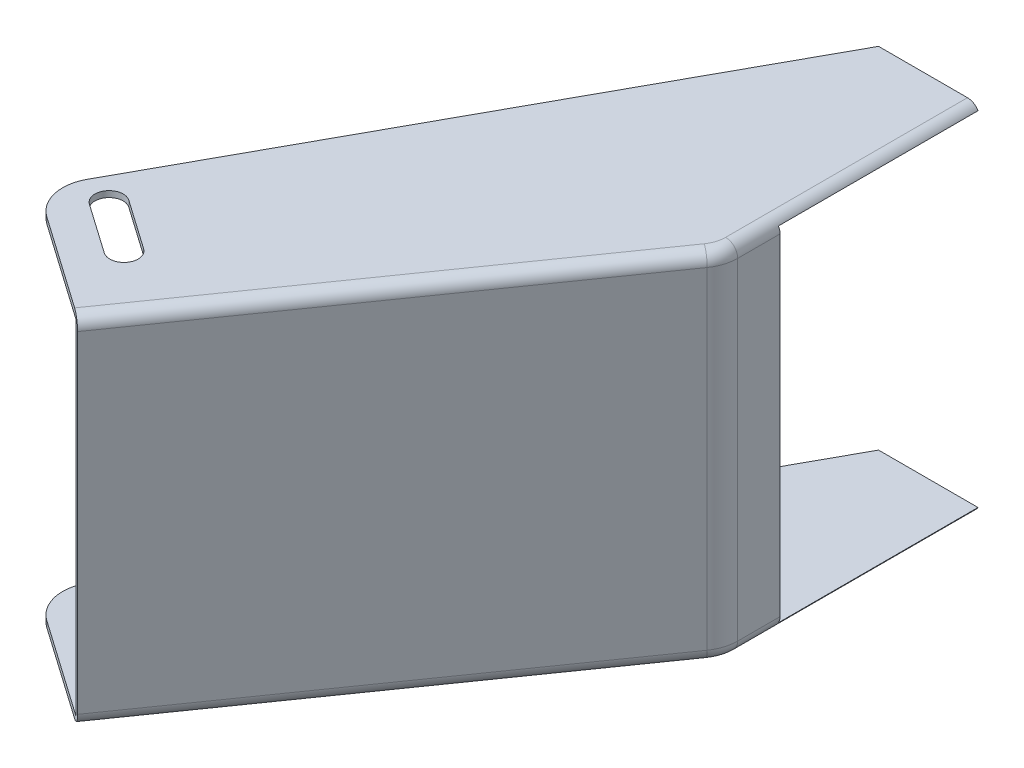
from build123d import *

# Parameters (mm, degrees)
BOSS_EXTRUDE1_DEPTH = 87.5
BOSS_EXTRUDE2_DEPTH = 1.5
FILLET1_R           = 10
FILLET2_R           = 3
CUT_EXTRUDE1_REACH  = 205.273
SKETCH3_W           = 49.374063928
SKETCH3_H           = 85


with BuildPart() as part:
    # Sketch1 → Boss-Extrude1 (new body)
    with BuildSketch(Plane(origin=(0, 0, 0), x_dir=(1, 0, 0), z_dir=(0, 1, 0))):
        Polygon((0, 0), (0, -63), (-65.96129018, -157.202485093), (-67.190018247, -156.342120439), (-1.5, -62.527051817), (-1.5, 0), align=None)
    extrude(amount=BOSS_EXTRUDE1_DEPTH)

    # Sketch2 → Boss-Extrude2 (add)
    with BuildSketch(Plane.XZ):
        with BuildLine():
            Line((0, 0), (-25, 0))
            Line((-25, 0), (-94.410596168, 126.398468668))
            ThreePointArc((-94.410596168, 126.398468668), (-95.384485345, 133.480683165), (-91.38102437, 139.403395594))
            Line((-91.38102437, 139.403395594), (-65.96129018, 157.202485093))
            Line((-65.96129018, 157.202485093), (0, 63))
            Line((0, 63), (0, 0))
        make_face()
        with BuildLine():
            Line((-72.511956454, 134.304040356), (-84.799237119, 125.700393811))
            ThreePointArc((-84.799237119, 125.700393811), (-89.673786801, 126.559908439), (-88.814272173, 131.434458121))
            Line((-88.814272173, 131.434458121), (-76.526991509, 140.038104666))
            ThreePointArc((-76.526991509, 140.038104666), (-71.652441827, 139.178590039), (-72.511956454, 134.304040356))
        make_face(mode=Mode.SUBTRACT)
    boss_extrude2 = extrude(amount=-BOSS_EXTRUDE2_DEPTH)

    # Mirror1: Boss-Extrude2 across plane
    add(boss_extrude2.mirror(Plane.ZX.offset(44)))

    # Fillet1
    fillet1_edges = [part.edges().sort_by_distance(p)[0] for p in [
        (0, 44, 63),
        (-1.5, 44, 62.527051817),
    ]]
    fillet(fillet1_edges, radius=FILLET1_R)

    # Fillet2
    fillet2_edges = [part.edges().sort_by_distance(p)[0] for p in [
        (0, 88, 29.923506056),
        (-33.884884869, 0, 111.392630784),
        (0, 0, 29.923506056),
        (-0.462830493, 0, 62.854070106),
        (-33.884884869, 88, 111.392630784),
        (-0.462830493, 88, 62.854070106),
    ]]
    fillet(fillet2_edges, radius=FILLET2_R)

    # Cut-Extrude1: up to this face of the body (flat: up to its plane)
    cut_extrude1_end = Plane(part.part.faces().sort_by_distance((0, 44, 29.923506056))[0])
    # Sketch3 → Cut-Extrude1 (cut, up to the picked face)
    with BuildSketch(Plane.ZY.offset(1.5), mode=Mode.PRIVATE) as cut_extrude1_sk1:
        with Locations((24.687031964, 44)):
            Rectangle(SKETCH3_W, SKETCH3_H)
    cut_extrude1_tool1 = split(extrude(cut_extrude1_sk1.sketch, amount=-CUT_EXTRUDE1_REACH, mode=Mode.PRIVATE), bisect_by=cut_extrude1_end, keep=Keep.BOTH, mode=Mode.PRIVATE)
    add(cut_extrude1_tool1.solids().sort_by(Axis((-1.5, 44, 24.687032), (1, 0, 0)))[0], mode=Mode.SUBTRACT)


solid = part.part
